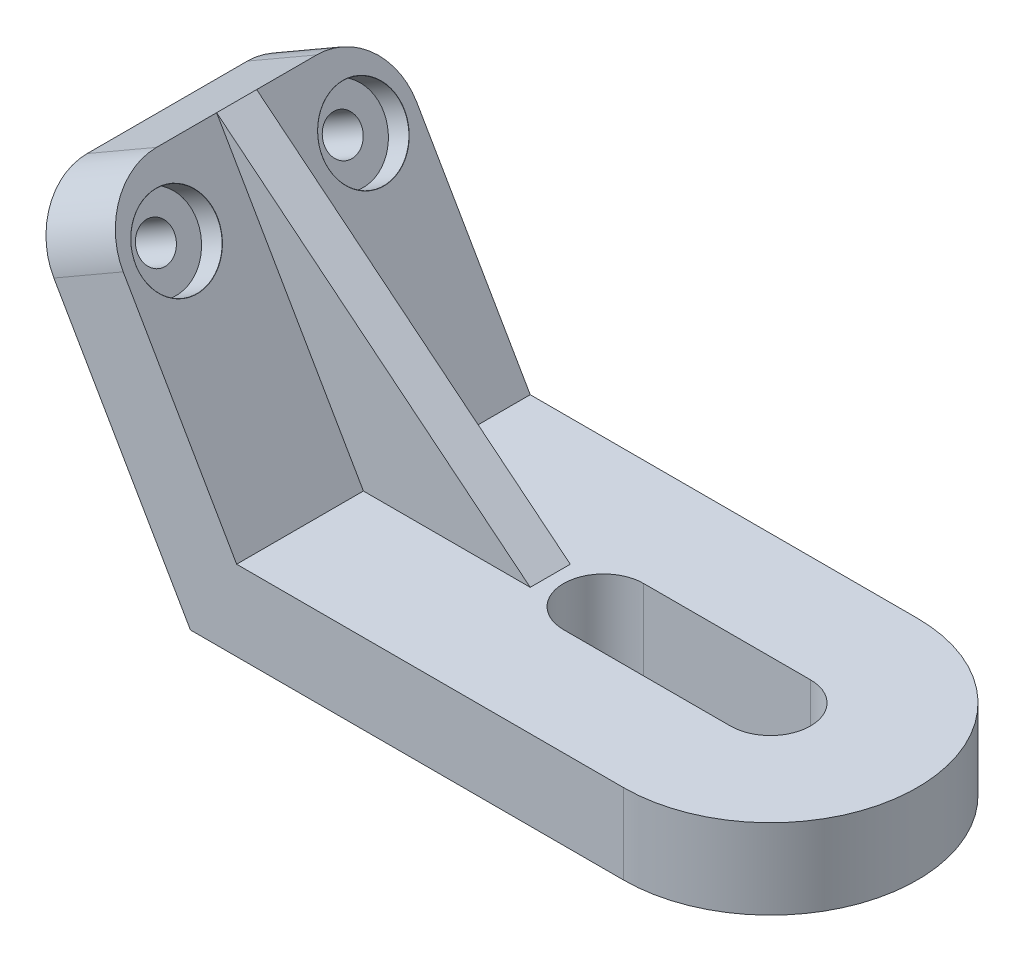
from build123d import *

# Parameters (mm, degrees)
BOSS_EXTRUDE1_DEPTH                    = 22
CBORE_FOR_M5_HEX_HEAD_BOLT1_AT_2_COUNT = 2
CBORE_FOR_M5_HEX_HEAD_BOLT1_AT_2_PITCH = 28
BOSS_EXTRUDE2_DEPTH                    = 3
CUT_EXTRUDE1_DEPTH                     = 87.362098425
FILLET2_R                              = 10
FILLET3_R                              = 10


with BuildPart() as part:
    # Sketch1 → Boss-Extrude1 (new, symmetric)
    with BuildSketch(Plane.XY):
        Polygon((-41.920628378, 5.592699718), (38.079371622, 5.592699718), (38.079371622, -6.407300282), (-48.848831609, -6.407300282), (-74.312933224, 37.697817484), (-63.920628378, 43.697817484), align=None)
    extrude(amount=BOSS_EXTRUDE1_DEPTH, both=True)

    # Sketch3 → CBORE for M5 Hex Head Bolt1 (revolve, cut)
    with BuildSketch(Plane(origin=(-58.920628378, 35.037563446, -14), x_dir=(-0.4999999999999982, 0.8660254037844396, 0), z_dir=(0, 0, 1))):
        Polygon((0, 0), (0, 34.052558883), (2.75, 34.052558883), (2.75, 3.58), (6.12, 3.58), (6.12, 0.024), (6.144, 0), align=None)
    cbore_for_m5_hex_head_bolt1 = revolve(axis=Axis((-53.421367064, 38.212563446, -14), (-0.8660254037844397, -0.4999999999999983, 0)), mode=Mode.SUBTRACT)

    # CBORE for M5 Hex Head Bolt1 at 2: CBORE for M5 Hex Head Bolt1 ×2
    with Locations(*[(0, 0, i * CBORE_FOR_M5_HEX_HEAD_BOLT1_AT_2_PITCH) for i in range(1, CBORE_FOR_M5_HEX_HEAD_BOLT1_AT_2_COUNT)]):
        add(cbore_for_m5_hex_head_bolt1, mode=Mode.SUBTRACT)

    # Sketch4 → Boss-Extrude2 (add, symmetric)
    with BuildSketch(Plane.XY):
        Polygon((-63.920628378, 43.697817484), (-41.920628378, 5.592699718), (-16.920628378, 5.592699718), align=None)
    extrude(amount=BOSS_EXTRUDE2_DEPTH, both=True)

    # Sketch5 → Cut-Extrude1 (cut, through all)
    with BuildSketch(Plane(origin=(0, 5.592699718, 0), x_dir=(1, 0, 0), z_dir=(0, 1, 0))):
        with BuildLine():
            ThreePointArc((16.079371622, 22), (31.635720831, 15.556349163), (38.079371622, -6.4e-08))
            Line((38.079371622, -6.4e-08), (38.079371622, 22))
            Line((38.079371622, 22), (16.079371622, 22))
        make_face()
        with BuildLine():
            ThreePointArc((38.079371622, -6.4e-08), (31.635720785, -15.556349209), (16.079371622, -22))
            Line((16.079371622, -22), (38.079371622, -22))
            Line((38.079371622, -22), (38.079371622, -6.4e-08))
        make_face()
        with BuildLine():
            Line((-8.920628378, -6), (16.079371622, -6))
            ThreePointArc((16.079371622, -6), (22.079371622, 0), (16.079371622, 6))
            Line((16.079371622, 6), (-8.920628378, 6))
            ThreePointArc((-8.920628378, 6), (-14.920628378, 0), (-8.920628378, -6))
        make_face()
    extrude(amount=-CUT_EXTRUDE1_DEPTH, mode=Mode.SUBTRACT)

    # Fillet2
    fillet2_edges = [part.edges().sort_by_distance(p)[0] for p in [
        (-69.116780801, 40.697817484, 22),
    ]]
    fillet(fillet2_edges, radius=FILLET2_R)

    # Fillet3
    fillet3_edges = [part.edges().sort_by_distance(p)[0] for p in [
        (-69.116780801, 40.697817484, -22),
    ]]
    fillet(fillet3_edges, radius=FILLET3_R)


solid = part.part
